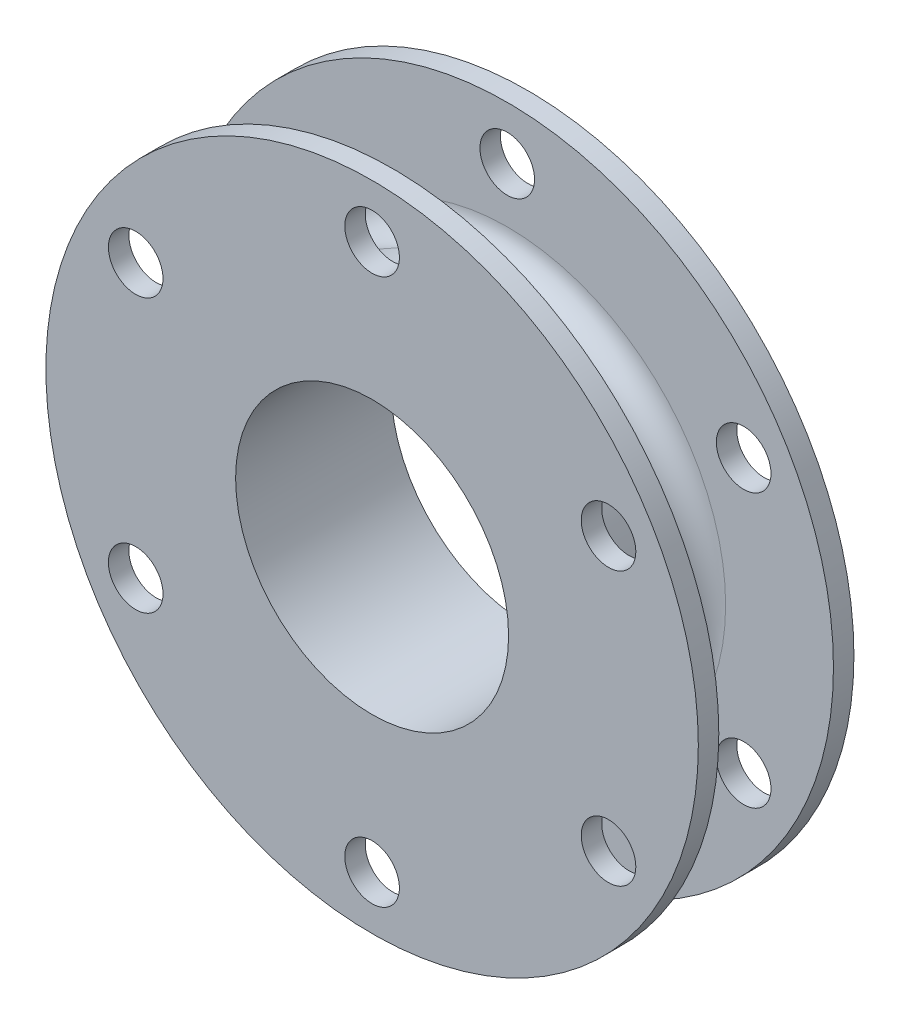
from build123d import *

# Parameters (mm, degrees)
ESBO_O1_R                = 23.9
ESBO_O1_R_2              = 2
ESBO_O1_R_3              = 10
RESSALTO_EXTRUS_O1_DEPTH = 1.5
ESBO_O2_R                = 14
ESBO_O2_R_2              = 10
RESSALTO_EXTRUS_O2_DEPTH = 9.9
RESSALTO_EXTRUS_O3_START = -1.5
ESBO_O3_R                = 23.9
ESBO_O3_R_2              = 2
ESBO_O3_R_3              = 10
RESSALTO_EXTRUS_O3_DEPTH = 1.5
FILETE1_R                = 2


with BuildPart() as part:
    # Esboço1 → Ressalto-extrusão1 (new body)
    with BuildSketch(Plane.XY):
        Circle(ESBO_O1_R)
        with Locations((0, -20)):
            Circle(ESBO_O1_R_2, mode=Mode.SUBTRACT)
        with Locations((-17.320508076, -10)):
            Circle(ESBO_O1_R_2, mode=Mode.SUBTRACT)
        with Locations((-17.320508076, 10)):
            Circle(ESBO_O1_R_2, mode=Mode.SUBTRACT)
        with Locations((17.320508076, -10)):
            Circle(ESBO_O1_R_2, mode=Mode.SUBTRACT)
        with Locations((17.320508076, 10)):
            Circle(ESBO_O1_R_2, mode=Mode.SUBTRACT)
        with Locations((0, 20)):
            Circle(ESBO_O1_R_2, mode=Mode.SUBTRACT)
        Circle(ESBO_O1_R_3, mode=Mode.SUBTRACT)
    extrude(amount=RESSALTO_EXTRUS_O1_DEPTH)

    # Esboço2 → Ressalto-extrusão2 (add)
    with BuildSketch(Plane.XY.offset(1.5)):
        Circle(ESBO_O2_R)
        Circle(ESBO_O2_R_2, mode=Mode.SUBTRACT)
    extrude(amount=RESSALTO_EXTRUS_O2_DEPTH)

    # Esboço3 → Ressalto-extrusão3 (add)
    with BuildSketch(Plane.XY.offset(11.4).offset(RESSALTO_EXTRUS_O3_START)):
        Circle(ESBO_O3_R)
        with Locations((-17.320508076, -10)):
            Circle(ESBO_O3_R_2, mode=Mode.SUBTRACT)
        with Locations((0, -20)):
            Circle(ESBO_O3_R_2, mode=Mode.SUBTRACT)
        with Locations((17.320508076, -10)):
            Circle(ESBO_O3_R_2, mode=Mode.SUBTRACT)
        with Locations((17.320508076, 10)):
            Circle(ESBO_O3_R_2, mode=Mode.SUBTRACT)
        with Locations((0, 20)):
            Circle(ESBO_O3_R_2, mode=Mode.SUBTRACT)
        with Locations((-17.320508076, 10)):
            Circle(ESBO_O3_R_2, mode=Mode.SUBTRACT)
        Circle(ESBO_O3_R_3, mode=Mode.SUBTRACT)
    extrude(amount=RESSALTO_EXTRUS_O3_DEPTH)

    # Filete1
    filete1_edges = [part.edges().sort_by_distance(p)[0] for p in [
        (-14, 0, 1.5),
        (-14, 0, 9.9),
    ]]
    fillet(filete1_edges, radius=FILETE1_R)


solid = part.part
